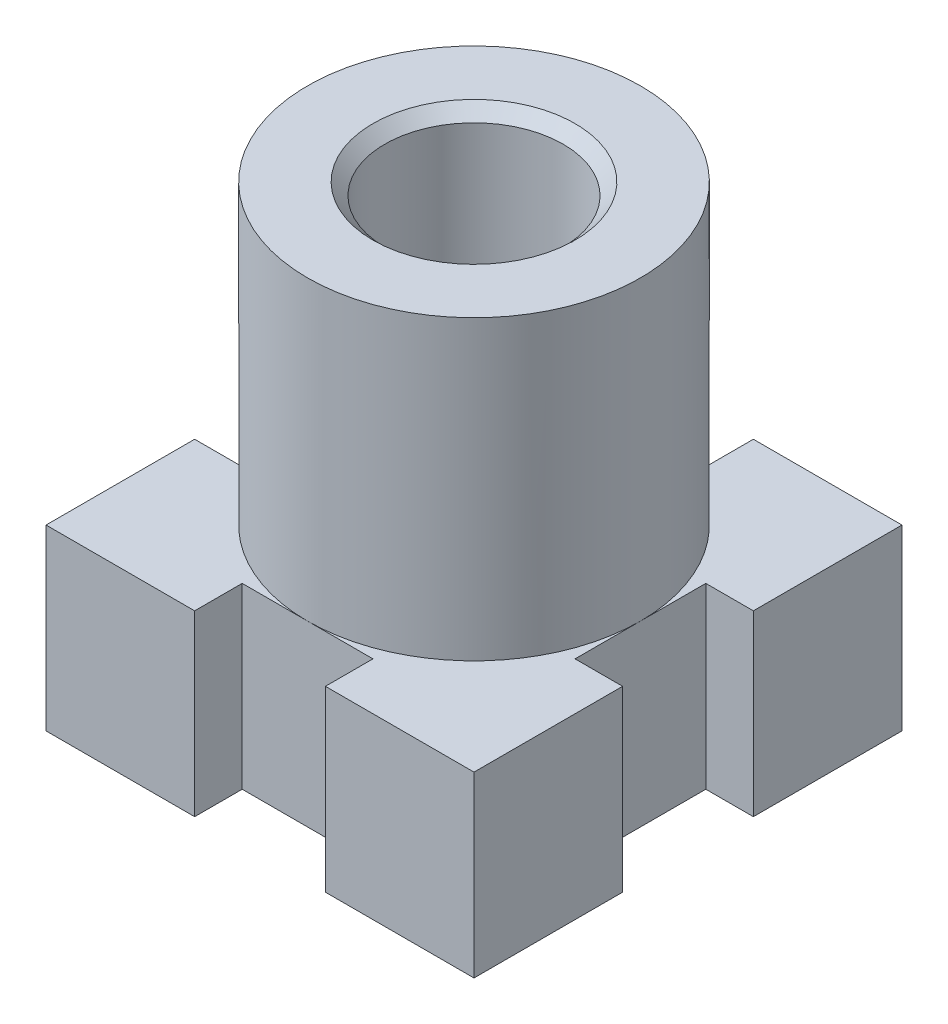
from build123d import *

# Parameters (mm, degrees)
BOSS_EXTRUDE1_DEPTH = 7.62
SKETCH2_R           = 7.112
SKETCH2_R_2         = 3.81
BOSS_EXTRUDE2_DEPTH = 12.7
CHAMFER1_SIZE       = 0.508


with BuildPart() as part:
    # Sketch1 → Boss-Extrude1 (new body)
    with BuildSketch(Plane(origin=(0, 0, 0), x_dir=(1, 0, 0), z_dir=(0, 1, 0))):
        Polygon((9.144, 2.794), (7.112, 2.794), (7.112, -2.794), (9.144, -2.794), (9.144, -9.144), (2.794, -9.144), (2.794, -7.112), (-2.794, -7.112), (-2.794, -9.144), (-9.144, -9.144), (-9.144, -2.794), (-7.112, -2.794), (-7.112, 2.794), (-9.144, 2.794), (-9.144, 9.144), (-2.794, 9.144), (-2.794, 7.112), (2.794, 7.112), (2.794, 9.144), (9.144, 9.144), align=None)
    extrude(amount=BOSS_EXTRUDE1_DEPTH)

    # Sketch2 → Boss-Extrude2 (add)
    with BuildSketch(Plane(origin=(0, 7.62, 0), x_dir=(1, 0, 0), z_dir=(0, 1, 0))):
        with Locations(Location((0, 0, 0), (0, 0, 270))):
            Circle(SKETCH2_R)
        with Locations(Location((0, 0, 0), (0, 0, 270))):
            Circle(SKETCH2_R_2, mode=Mode.SUBTRACT)
    extrude(amount=BOSS_EXTRUDE2_DEPTH)

    # Chamfer1
    chamfer1_edges = [part.edges().sort_by_distance(p)[0] for p in [
        (0, 20.32, -3.81),
    ]]
    chamfer(chamfer1_edges, length=CHAMFER1_SIZE)


solid = part.part
